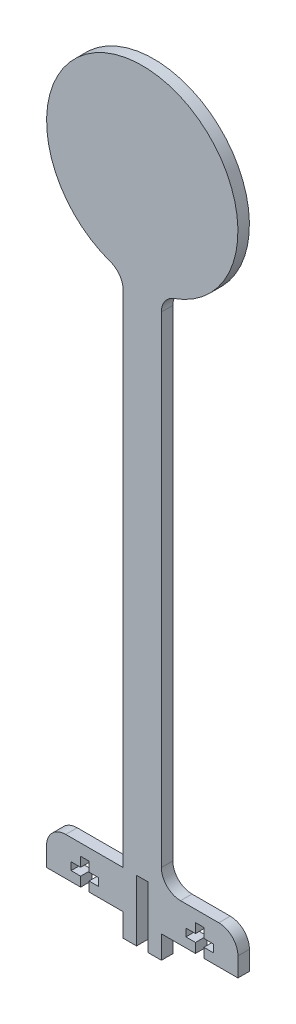
from build123d import *

# Parameters (mm, degrees)
BOSS_EXTRUDE1_DEPTH = 3
FILLET1_R           = 5


with BuildPart() as part:
    # Sketch1 → Boss-Extrude1 (new body)
    with BuildSketch(Plane.XY):
        with BuildLine():
            Line((-5, -25), (-5, -159))
            Line((-5, -159), (-25, -159))
            Line((-25, -159), (-25, -169))
            Line((-25, -169), (-16.1, -169))
            Line((-16.1, -169), (-16.1, -166.5))
            Line((-16.1, -166.5), (-18.6, -166.5))
            Line((-18.6, -166.5), (-18.6, -164.5))
            Line((-18.6, -164.5), (-16.1, -164.5))
            Line((-16.1, -164.5), (-16.1, -162))
            Line((-16.1, -162), (-13.9, -162))
            Line((-13.9, -162), (-13.9, -164.5))
            Line((-13.9, -164.5), (-11.4, -164.5))
            Line((-11.4, -164.5), (-11.4, -166.5))
            Line((-11.4, -166.5), (-13.9, -166.5))
            Line((-13.9, -166.5), (-13.9, -169))
            Line((-13.9, -169), (-5, -169))
            Line((-5, -169), (-5, -175))
            Line((-5, -175), (-1.5, -175))
            Line((-1.5, -175), (-1.5, -159))
            Line((-1.5, -159), (1.5, -159))
            Line((1.5, -159), (1.5, -175))
            Line((1.5, -175), (5, -175))
            Line((5, -175), (5, -169))
            Line((5, -169), (13.9, -169))
            Line((13.9, -169), (13.9, -166.5))
            Line((13.9, -166.5), (11.4, -166.5))
            Line((11.4, -166.5), (11.4, -164.5))
            Line((11.4, -164.5), (13.9, -164.5))
            Line((13.9, -164.5), (13.9, -162))
            Line((13.9, -162), (16.1, -162))
            Line((16.1, -162), (16.1, -164.5))
            Line((16.1, -164.5), (18.6, -164.5))
            Line((18.6, -164.5), (18.6, -166.5))
            Line((18.6, -166.5), (16.1, -166.5))
            Line((16.1, -166.5), (16.1, -169))
            Line((16.1, -169), (25, -169))
            Line((25, -169), (25, -159))
            Line((25, -159), (5, -159))
            Line((5, -159), (5, -25))
            Line((5, -25), (5, -24.494897428))
            ThreePointArc((5, -24.494897428), (0, 25), (-5, -24.494897428))
            Line((-5, -24.494897428), (-5, -25))
        make_face()
    extrude(amount=BOSS_EXTRUDE1_DEPTH)

    # Fillet1
    fillet1_edges = [part.edges().sort_by_distance(p)[0] for p in [
        (5, -24.494897428, 1.5),
        (5, -159, 1.5),
        (25, -159, 1.5),
        (-25, -159, 1.5),
        (-5, -24.494897428, 1.5),
    ]]
    fillet(fillet1_edges, radius=FILLET1_R)


solid = part.part
